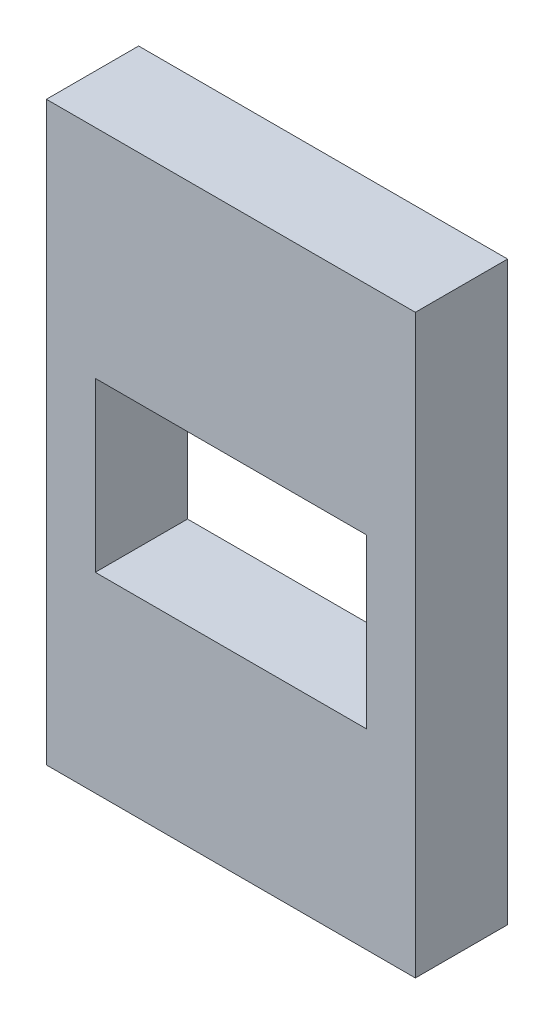
from build123d import *

# Parameters (mm, degrees)
ESQUISSE1_W             = 32
ESQUISSE1_H             = 50
BOSS_EXTRU_1_DEPTH      = 8
ESQUISSE2_W             = 23.52
ESQUISSE2_H             = 14.57
ENL_V_MAT_EXTRU_1_DEPTH = 8


with BuildPart() as part:
    # Esquisse1 → Boss.-Extru.1 (new body)
    with BuildSketch(Plane.XY):
        Rectangle(ESQUISSE1_W, ESQUISSE1_H)
    extrude(amount=BOSS_EXTRU_1_DEPTH)

    # Esquisse2 → Enlèv. mat.-Extru.1 (cut)
    with BuildSketch(Plane(origin=(0, 0, 0), x_dir=(-1, 0, 0), z_dir=(0, 0, -1))):
        with Locations((0, -1.125)):
            Rectangle(ESQUISSE2_W, ESQUISSE2_H)
    extrude(amount=-ENL_V_MAT_EXTRU_1_DEPTH, mode=Mode.SUBTRACT)


solid = part.part
